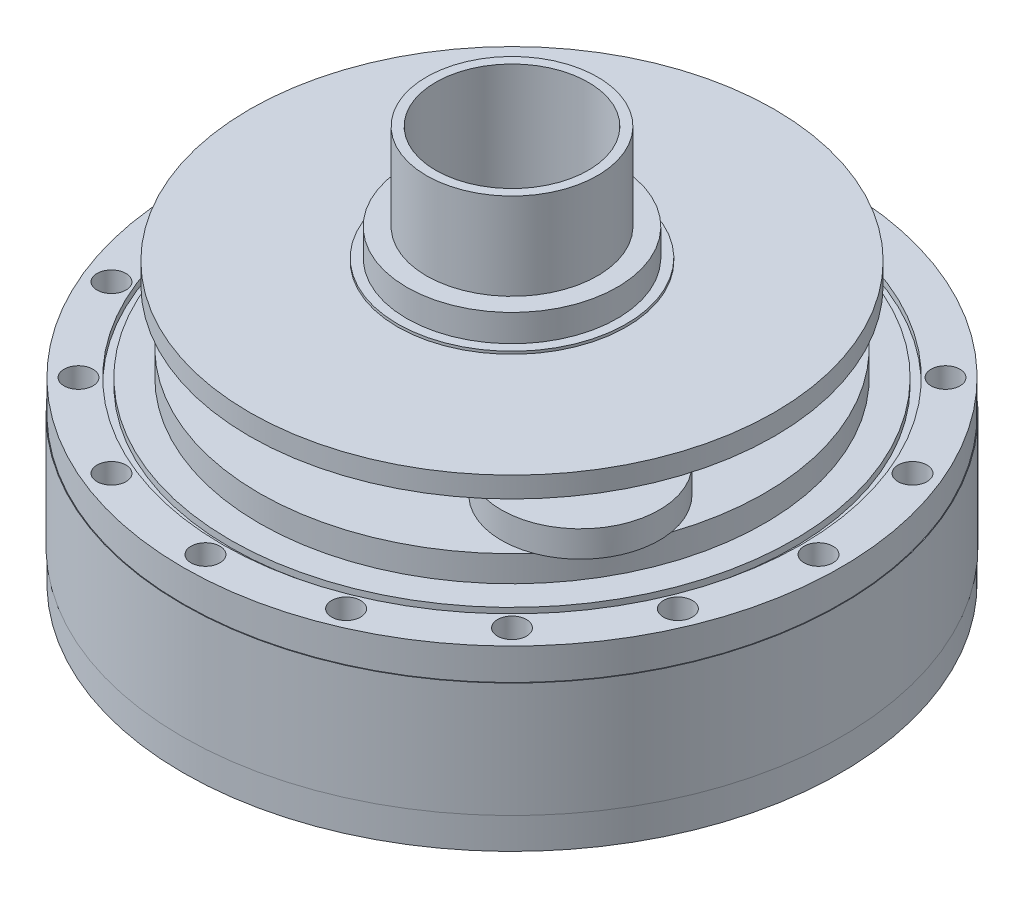
from build123d import *

# Parameters (mm, degrees)
SKETCH2_R           = 53
CUT_EXTRUDE1_DEPTH  = 13
SKETCH3_R           = 5.5
CUT_EXTRUDE2_DEPTH  = 233.304143312
SKETCH4_R           = 6
CUT_EXTRUDE3_DEPTH  = 20
SKETCH5_R           = 30
BOSS_EXTRUDE1_DEPTH = 10


with BuildPart() as part:
    # Sketch1 → Revolve1 (revolve)
    with BuildSketch(Plane(origin=(0, 0, 0), x_dir=(0, 0, -1), z_dir=(1, 0, 0))):
        Polygon((-29, 0), (-99.5, 0), (-99.5, 5), (-125, 5), (-125, 17), (-125.25, 17), (-125.25, 60.6), (-125, 60.6), (-125, 72.6), (-110, 72.6), (-110, 70.1), (-107, 70.1), (-107, 72.6), (-96, 72.6), (-96, 82.5), (-40, 82.5), (-40, 103.15), (-99.75, 103.15), (-99.75, 111), (-43.5, 111), (-43.5, 112), (-40, 112), (-40, 122.3), (-32.5, 122.3), (-32.5, 155.3), (-29, 155.3), align=None)
    revolve(axis=Axis((0, 155.3, 0), (0, -1, 0)))

    # Sketch2 → Cut-Extrude1 (cut)
    with BuildSketch(Plane.XZ):
        with Locations(Location((0, 0, 0), (0, 0, 270))):
            Circle(SKETCH2_R)
    extrude(amount=-CUT_EXTRUDE1_DEPTH, mode=Mode.SUBTRACT)

    # Sketch3 → Cut-Extrude2 (cut, through all)
    with BuildSketch(Plane.XZ.offset(-5)):
        with Locations(Location((-116.5, 0, 0), (0, 0, 270))):
            Circle(SKETCH3_R)
        with Locations(Location((-107.631965538, 44.582619871, 0), (0, 0, 270))):
            Circle(SKETCH3_R)
        with Locations(Location((-82.377940008, 82.377940008, 0), (0, 0, 270))):
            Circle(SKETCH3_R)
        with Locations(Location((-44.582619871, 107.631965538, 0), (0, 0, 270))):
            Circle(SKETCH3_R)
        with Locations(Location((0, 116.5, 0), (0, 0, 270))):
            Circle(SKETCH3_R)
        with Locations(Location((44.582619871, 107.631965538, 0), (0, 0, 270))):
            Circle(SKETCH3_R)
        with Locations(Location((82.377940008, 82.377940008, 0), (0, 0, 270))):
            Circle(SKETCH3_R)
        with Locations(Location((107.631965538, 44.582619871, 0), (0, 0, 270))):
            Circle(SKETCH3_R)
        with Locations(Location((116.5, 0, 0), (0, 0, 270))):
            Circle(SKETCH3_R)
        with Locations(Location((107.631965538, -44.582619871, 0), (0, 0, 270))):
            Circle(SKETCH3_R)
        with Locations(Location((82.377940008, -82.377940008, 0), (0, 0, 270))):
            Circle(SKETCH3_R)
        with Locations(Location((0, -116.5, 0), (0, 0, 270))):
            Circle(SKETCH3_R)
        with Locations(Location((-44.582619871, -107.631965538, 0), (0, 0, 270))):
            Circle(SKETCH3_R)
        with Locations(Location((-82.377940008, -82.377940008, 0), (0, 0, 270))):
            Circle(SKETCH3_R)
    extrude(amount=-CUT_EXTRUDE2_DEPTH, mode=Mode.SUBTRACT)

    # Sketch4 → Cut-Extrude3 (cut)
    with BuildSketch(Plane(origin=(0, 0, 0), x_dir=(-1, 0, 0), z_dir=(0, -1, 0))):
        with Locations(Location((80, 0, 0), (0, 0, 90))):
            Circle(SKETCH4_R)
        with Locations(Location((69.282032303, -40, 0), (0, 0, 90))):
            Circle(SKETCH4_R)
        with Locations(Location((0, -80, 0), (0, 0, 90))):
            Circle(SKETCH4_R)
        with Locations(Location((-40, -69.282032303, 0), (0, 0, 90))):
            Circle(SKETCH4_R)
        with Locations(Location((-69.282032303, -40, 0), (0, 0, 90))):
            Circle(SKETCH4_R)
        with Locations(Location((-69.282032303, 40, 0), (0, 0, 90))):
            Circle(SKETCH4_R)
        with Locations(Location((-40, 69.282032303, 0), (0, 0, 90))):
            Circle(SKETCH4_R)
        with Locations(Location((0, 80, 0), (0, 0, 90))):
            Circle(SKETCH4_R)
        with Locations(Location((69.282032303, 40, 0), (0, 0, 90))):
            Circle(SKETCH4_R)
    extrude(amount=-CUT_EXTRUDE3_DEPTH, mode=Mode.SUBTRACT)

    # Sketch5 → Boss-Extrude1 (add)
    with BuildSketch(Plane(origin=(0, 82.5, 0), x_dir=(1, 0, 0), z_dir=(0, 1, 0))):
        with Locations(Location((0, 71, 0), (0, 0, 50.244401083))):
            Circle(SKETCH5_R)
        with Locations(Location((61.487803669, -35.5, 0), (0, 0, 9.755598917))):
            Circle(SKETCH5_R)
        with Locations(Location((-61.487803669, -35.5, 0), (0, 0, 170.244401083))):
            Circle(SKETCH5_R)
    extrude(amount=BOSS_EXTRUDE1_DEPTH)


solid = part.part
